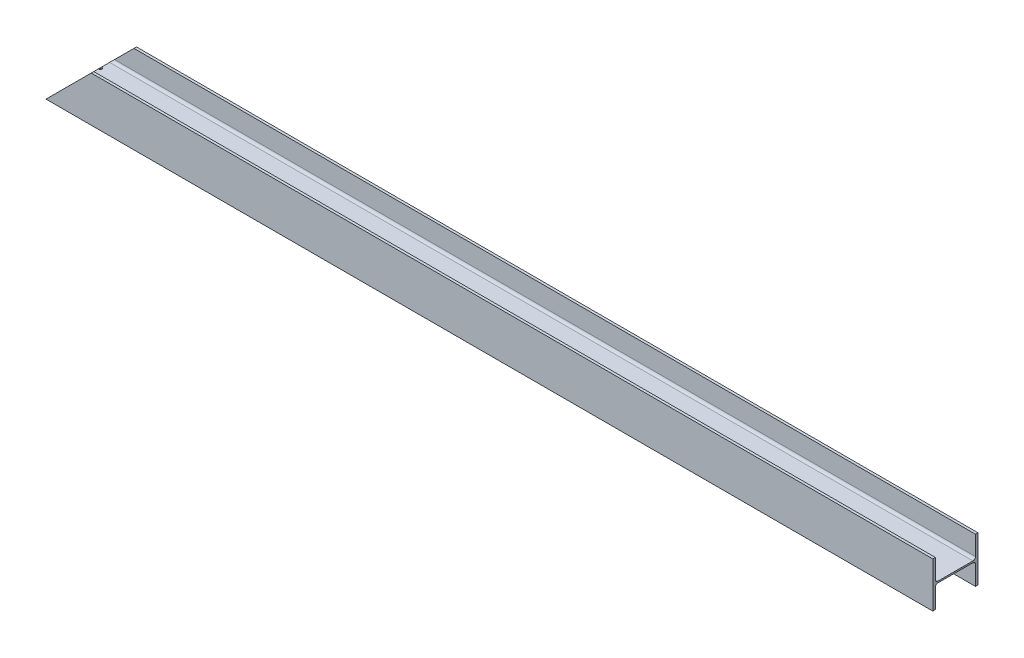
from build123d import *

# Parameters (mm, degrees)
UNIVERSAL_COLUMN_ICS_250UC72_9_1_DEPTH = 5000
SKETCH3_R                              = 9
CUT_EXTRUDE2_DEPTH                     = 14.2
SKETCH20_R                             = 9
CUT_EXTRUDE19_DEPTH                    = 4.3
SKETCH21_W                             = 254
SKETCH21_H                             = 254
CUT_EXTRUDE20_DEPTH                    = 10
SKETCH22_W                             = 282
SKETCH22_H                             = 282
CUT_EXTRUDE21_DEPTH                    = 10
CUT_EXTRUDE22_DEPTH                    = 4999.074129102


with BuildPart() as part:
    # Sketch1 → Universal Column_ics 250UC72.9(1) (new body)
    with BuildSketch(Plane(origin=(0, 0, 0), x_dir=(0, 1, 0), z_dir=(-1, 0, 0))):
        with BuildLine():
            Line((-127, -127), (127, -127))
            Line((127, -127), (127, -112.8))
            Line((127, -112.8), (18.3, -112.8))
            ThreePointArc((18.3, -112.8), (8.400505063, -108.699494937), (4.3, -98.8))
            Line((4.3, -98.8), (4.3, 98.8))
            ThreePointArc((4.3, 98.8), (8.400505063, 108.699494937), (18.3, 112.8))
            Line((18.3, 112.8), (127, 112.8))
            Line((127, 112.8), (127, 127))
            Line((127, 127), (-127, 127))
            Line((-127, 127), (-127, 112.8))
            Line((-127, 112.8), (-18.3, 112.8))
            ThreePointArc((-18.3, 112.8), (-8.400505063, 108.699494937), (-4.3, 98.8))
            Line((-4.3, 98.8), (-4.3, -98.8))
            ThreePointArc((-4.3, -98.8), (-8.400505063, -108.699494937), (-18.3, -112.8))
            Line((-18.3, -112.8), (-127, -112.8))
            Line((-127, -112.8), (-127, -127))
        make_face()
    extrude(amount=UNIVERSAL_COLUMN_ICS_250UC72_9_1_DEPTH)

    # Sketch3 → Cut-Extrude2 (cut)
    with BuildSketch(Plane(origin=(-4890.5, 0, -127), x_dir=(0, -1, 0), z_dir=(0, 0, -1))):
        with Locations(Location((48, -33.5, 0), (0, 0, 180))):
            Circle(SKETCH3_R)
        with Locations(Location((48, 14.5, 0), (0, 0, 180))):
            Circle(SKETCH3_R)
        with Locations(Location((-48, -33.5, 0), (0, 0, 180))):
            Circle(SKETCH3_R)
        with Locations(Location((-48, 14.5, 0), (0, 0, 180))):
            Circle(SKETCH3_R)
    extrude(amount=-CUT_EXTRUDE2_DEPTH, mode=Mode.SUBTRACT)

    # Sketch20 → Cut-Extrude19 (cut, symmetric)
    with BuildSketch(Plane(origin=(-4890.5, 0, 0), x_dir=(0, 0, -1), z_dir=(0, 1, 0))):
        with Locations(Location((45, -33.5, 0), (0, 0, 90))):
            Circle(SKETCH20_R)
        with Locations(Location((-45, -33.5, 0), (0, 0, 90))):
            Circle(SKETCH20_R)
        with Locations(Location((45, 14.5, 0), (0, 0, 90))):
            Circle(SKETCH20_R)
        with Locations(Location((-45, 14.5, 0), (0, 0, 90))):
            Circle(SKETCH20_R)
    extrude(amount=CUT_EXTRUDE19_DEPTH, both=True, mode=Mode.SUBTRACT)

    # Sketch21 → Cut-Extrude20 (cut)
    with BuildSketch(Plane(origin=(-5000, 0, 0), x_dir=(0, 1, 0), z_dir=(-1, 0, 0))):
        Rectangle(SKETCH21_W, SKETCH21_H)
    extrude(amount=-CUT_EXTRUDE20_DEPTH, mode=Mode.SUBTRACT)

    # Sketch22 → Cut-Extrude21 (cut)
    with BuildSketch(Plane(origin=(0, 0, 0), x_dir=(0, 1, 0), z_dir=(-1, 0, 0))):
        Rectangle(SKETCH22_W, SKETCH22_H)
    extrude(amount=CUT_EXTRUDE21_DEPTH, mode=Mode.SUBTRACT)

    # Sketch23 → Cut-Extrude22 (cut, through all)
    with BuildSketch(Plane.XY.offset(127)):
        Polygon((-4990, -127), (-4736, 127), (-4990, 127), align=None)
    extrude(amount=-CUT_EXTRUDE22_DEPTH, mode=Mode.SUBTRACT)


solid = part.part
